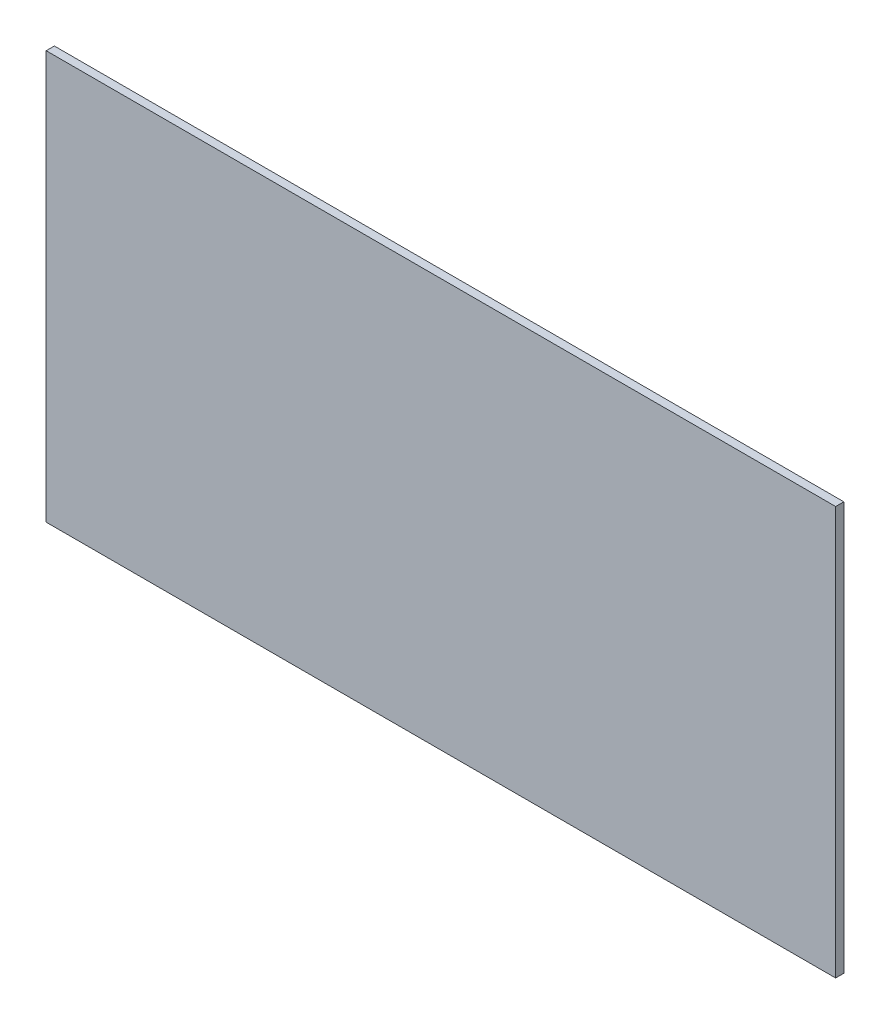
from build123d import *

# Parameters (mm, degrees)
SKETCH1_W           = 290
SKETCH1_H           = 150
BOSS_EXTRUDE1_DEPTH = 3


with BuildPart() as part:
    # Sketch1 → Boss-Extrude1 (new body)
    with BuildSketch(Plane.XY):
        with Locations((145, 75)):
            Rectangle(SKETCH1_W, SKETCH1_H)
    extrude(amount=BOSS_EXTRUDE1_DEPTH)


solid = part.part
